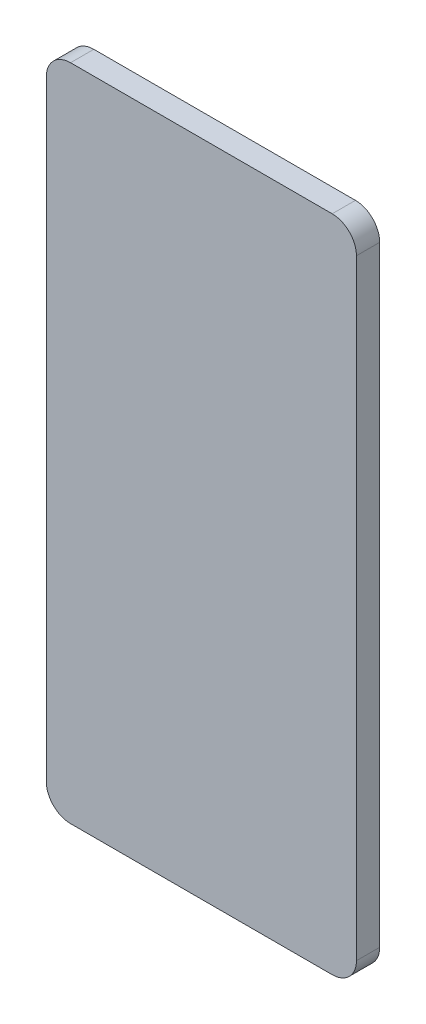
from build123d import *

# Parameters (mm, degrees)
BOSS_EXTRUDE1_DEPTH = 2.54


with BuildPart() as part:
    # Sketch2 → Boss-Extrude1 (new body)
    with BuildSketch(Plane.XY):
        with BuildLine():
            Line((-16.93418, -33.3375), (-16.93418, 33.3375))
            ThreePointArc((-16.93418, 33.3375), (-16.158985376, 35.208985376), (-14.2875, 35.98418))
            Line((-14.2875, 35.98418), (14.2875, 35.98418))
            ThreePointArc((14.2875, 35.98418), (16.158985376, 35.208985376), (16.93418, 33.3375))
            Line((16.93418, 33.3375), (16.93418, -33.3375))
            ThreePointArc((16.93418, -33.3375), (16.158985376, -35.208985376), (14.2875, -35.98418))
            Line((14.2875, -35.98418), (-14.2875, -35.98418))
            ThreePointArc((-14.2875, -35.98418), (-16.158985376, -35.208985376), (-16.93418, -33.3375))
        make_face()
    extrude(amount=BOSS_EXTRUDE1_DEPTH)


solid = part.part
